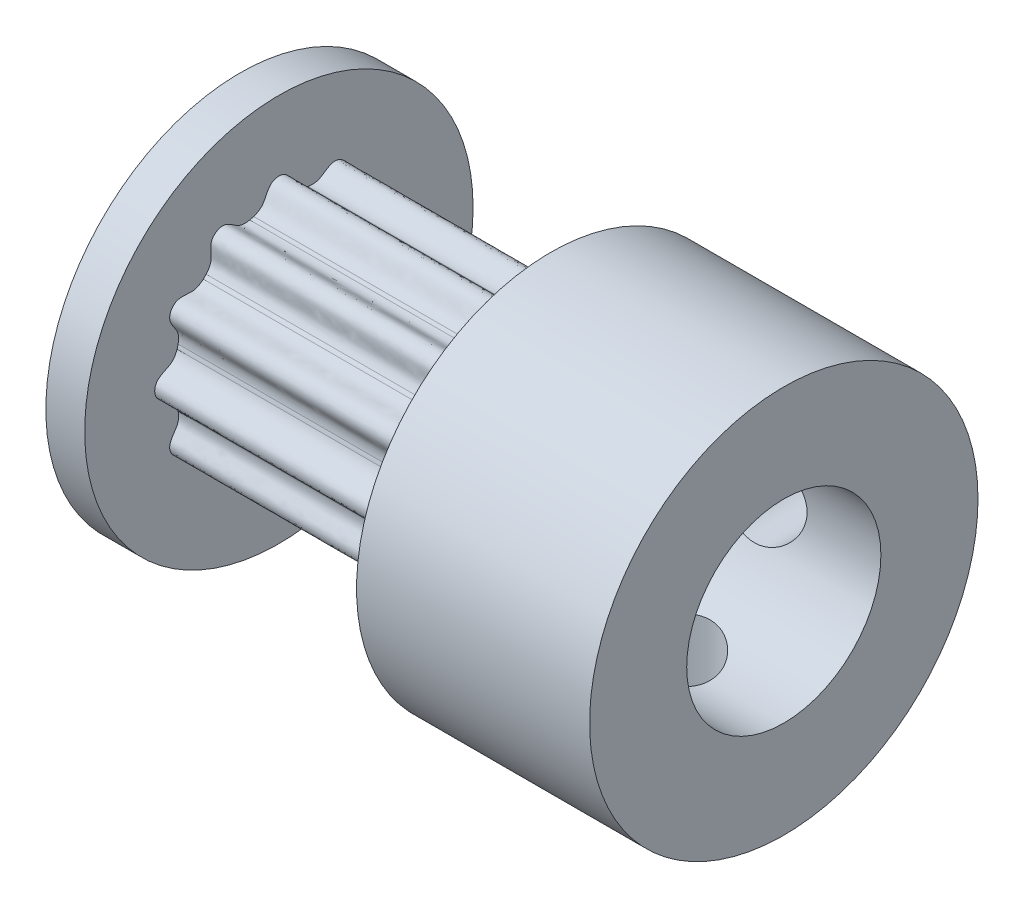
from build123d import *

# Parameters (mm, degrees)
TOOTH_DEPTH         = 9
TEETH_COUNT         = 12
SKETCH3_R           = 1.1
SETSCREWHOLE1_DEPTH = 6
SKETCH4_R           = 1.1
SETSCREWHOLE2_DEPTH = 6


with BuildPart() as part:
    # Sketch1 → Base (revolve)
    with BuildSketch(Plane(origin=(0, 0, 0), x_dir=(1, 0, 0), z_dir=(0, 1, 0))):
        Polygon((0, 2.5), (-14, 2.5), (-14, 5), (-13, 5), (-13, 2.7), (-6, 2.7), (-6, 5), (0, 5), align=None)
    revolve(axis=Axis((0, 0, 0), (-1, 0, 0)))

    # Sketch2 → Tooth (add)
    with BuildSketch(Plane.ZY.offset(14)):
        with BuildLine():
            add(Edge.make_bspline(
                [(-0.698010078, 2.605009074), (-0.579149714, 2.640123387), (-0.432927003, 2.70952093), (-0.293263805, 3.014827853), (-0.22723688, 3.122148687), (-0.139060677, 3.165998233), (-0.111390876, 3.179758275), (-0.051398578, 3.197922343), (0.051398578, 3.197922343), (0.111390876, 3.179758275), (0.139060677, 3.165998233), (0.22723688, 3.122148687), (0.293263805, 3.014827853), (0.432927003, 2.70952093), (0.579149714, 2.640123387), (0.698010078, 2.605009074)],
                knots=[0, 0, 0, 0, 0.168535538, 0.217849363, 0.409696975, 0.409696975, 0.409696975, 0.469898992, 0.530101008, 0.590303025, 0.590303025, 0.590303025, 0.782150637, 0.831464462, 1, 1, 1, 1], degree=3))
            ThreePointArc((-0.698010078, 2.605009074), (0, 2.7), (0.698010078, 2.605009074))
        make_face()
    tooth = extrude(amount=-TOOTH_DEPTH)

    # Teeth: Tooth ×12 about axis
    teeth_axis = Axis((0, 0, 0), (1, 0, 0))
    for i in range(1, TEETH_COUNT):
        add(tooth.rotate(teeth_axis, i * 360 / TEETH_COUNT))

    # Sketch3 → SetScrewHole1 (cut)
    with BuildSketch(Plane.XY):
        with Locations((-3, 0)):
            Circle(SKETCH3_R)
    extrude(amount=-SETSCREWHOLE1_DEPTH, mode=Mode.SUBTRACT)

    # Sketch4 → SetScrewHole2 (cut)
    with BuildSketch(Plane(origin=(0, 0, 0), x_dir=(1, 0, 0), z_dir=(0, 1, 0))):
        with Locations(Location((-3, 0, 0), (0, 0, 270))):
            Circle(SKETCH4_R)
    extrude(amount=-SETSCREWHOLE2_DEPTH, mode=Mode.SUBTRACT)


solid = part.part
